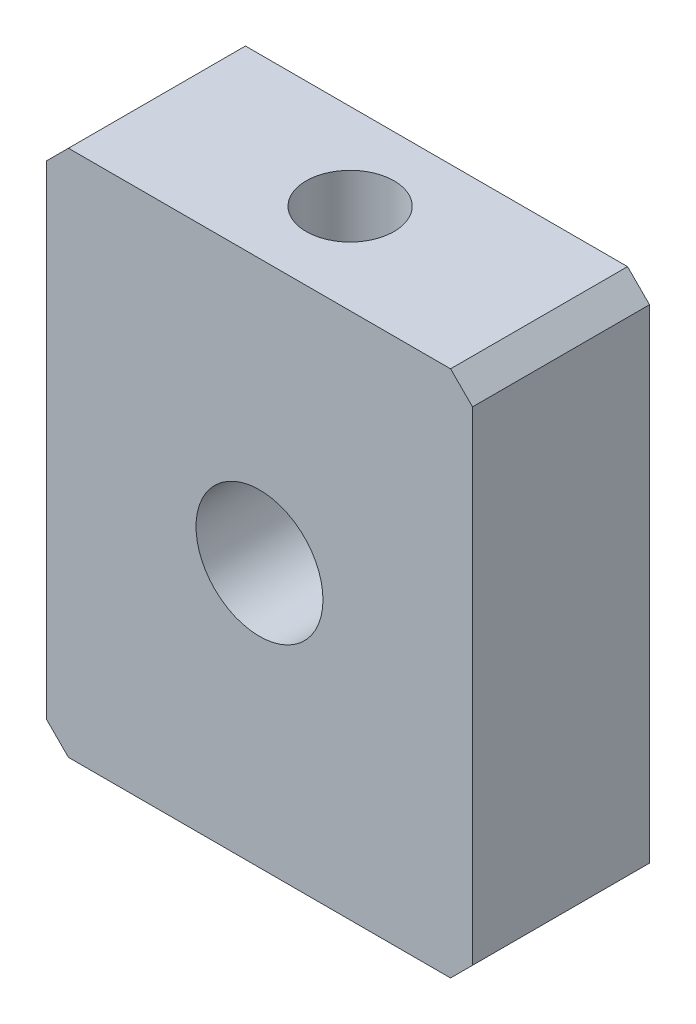
from build123d import *

# Parameters (mm, degrees)
SKETCH_1_W               = 96.91
SKETCH_1_H               = 120
EXTRUDE_1_DEPTH          = 40.26
CUT_EXTRUDE_1_DEPTH      = 637.874859919
CUT_EXTRUDE_1_DEPTH_BACK = 637.874859919
SKETCH_2_R               = 10
CUT_EXTRUDE_2_DEPTH      = 485.260622689
CUT_EXTRUDE_2_DEPTH_BACK = 20
SKETCH_3_R               = 10
CHAMFER_1_SIZE           = 5
SKETCH_4_R               = 14.438127561
CUT_EXTRUDE_3_DEPTH      = 500


with BuildPart() as part:
    # 草图1 → 凸台-拉伸1 (new body)
    with BuildSketch(Plane.XY.offset(52.065067551)):
        with Locations((-417.804133345, 371.961966114)):
            Rectangle(SKETCH_1_W, SKETCH_1_H)
    extrude(amount=-EXTRUDE_1_DEPTH)

    # 草图2 → 切除-拉伸1 (cut, two sides: drawn at the far end of the back side and taken through both)
    with BuildSketch(Plane.XY.offset(52.065067551).offset(-CUT_EXTRUDE_1_DEPTH_BACK)):
        with Locations((-417.804133345, 371.961966114)):
            Circle(SKETCH_2_R)
        with Locations((-494.338767254, 524.640290491)):
            Circle(SKETCH_2_R)
    extrude(amount=CUT_EXTRUDE_1_DEPTH + CUT_EXTRUDE_1_DEPTH_BACK, mode=Mode.SUBTRACT)

    # 草图3 → 切除-拉伸2 (cut, two sides: drawn at the far end of the back side and taken through both)
    with BuildSketch(Plane(origin=(0, 431.961966114, 0), x_dir=(1, 0, 0), z_dir=(0, 1, 0)).offset(-CUT_EXTRUDE_2_DEPTH_BACK)):
        with Locations(Location((-417.804133345, -31.455067551, 0), (0, 0, 90))):
            Circle(SKETCH_3_R)
    extrude(amount=CUT_EXTRUDE_2_DEPTH + CUT_EXTRUDE_2_DEPTH_BACK, mode=Mode.SUBTRACT)

    # 倒角1
    chamfer_1_edges = [part.edges().sort_by_distance(p)[0] for p in [
        (-369.349133345, 311.961966114, 31.935067551),
        (-369.349133345, 431.961966114, 31.935067551),
        (-466.259133345, 431.961966114, 31.935067551),
        (-466.259133345, 311.961966114, 31.935067551),
    ]]
    chamfer(chamfer_1_edges, length=CHAMFER_1_SIZE)

    # 草图4 → 切除-拉伸3 (cut)
    with BuildSketch(Plane.XY.offset(52.065067551)):
        with Locations((-417.804133345, 371.961966114)):
            Circle(SKETCH_4_R)
    extrude(amount=-CUT_EXTRUDE_3_DEPTH, mode=Mode.SUBTRACT)


solid = part.part
